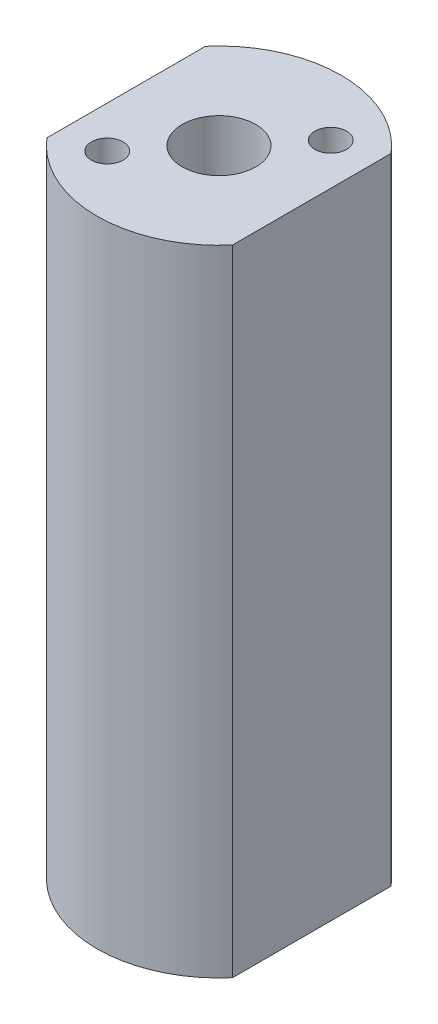
from build123d import *

# Parameters (mm, degrees)
BOSS_EXTRUDE1_DEPTH = 40
SKETCH2_R           = 2.32
SKETCH2_R_2         = 1
CUT_EXTRUDE1_DEPTH  = 40


with BuildPart() as part:
    # Sketch1 → Boss-Extrude1 (new body)
    with BuildSketch(Plane(origin=(0, 0, 0), x_dir=(1, 0, 0), z_dir=(0, 1, 0))):
        with BuildLine():
            Line((-5.85, 4.99905241), (-5.85, -4.99905241))
            ThreePointArc((-5.85, -4.99905241), (0, -7.695), (5.85, -4.99905241))
            Line((5.85, -4.99905241), (5.85, 4.99905241))
            ThreePointArc((5.85, 4.99905241), (0, 7.695), (-5.85, 4.99905241))
        make_face()
    extrude(amount=BOSS_EXTRUDE1_DEPTH)

    # Sketch2 → Cut-Extrude1 (cut)
    with BuildSketch(Plane(origin=(0, 40, 0), x_dir=(1, 0, 0), z_dir=(0, 1, 0))):
        with Locations(Location((0, 0, 0), (0, 0, 270))):
            Circle(SKETCH2_R)
        with Locations(Location((3.230749736, 3.81605243, 0), (0, 0, 270))):
            Circle(SKETCH2_R_2)
        with Locations(Location((-3.230749736, -3.81605243, 0), (0, 0, 270))):
            Circle(SKETCH2_R_2)
    extrude(amount=-CUT_EXTRUDE1_DEPTH, mode=Mode.SUBTRACT)


solid = part.part
